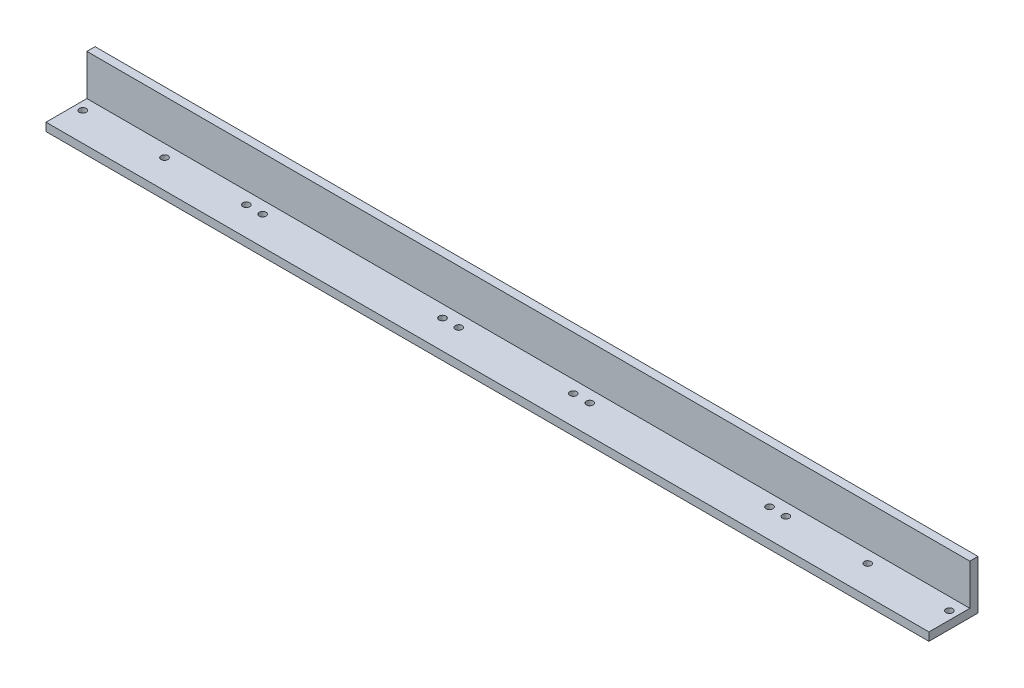
from build123d import *

# Parameters (mm, degrees)
EXTRUDE_THIN1_DEPTH = 342.9
CUT_EXTRUDE4_REACH  = 348.468
SKETCH2_R           = 2.667


with BuildPart() as part:
    # Sketch1 → Extrude-Thin1 (new, symmetric)
    with BuildSketch(Plane(origin=(0, 0, 0), x_dir=(0, 0, -1), z_dir=(1, 0, 0))):
        Polygon((-38.1, 0), (0, 0), (0, 38.1), (-6.35, 38.1), (-6.35, 6.35), (-38.1, 6.35), align=None)
    extrude(amount=EXTRUDE_THIN1_DEPTH, both=True)

    # Sketch2 → Cut-Extrude4 (cut, up to next)
    with BuildSketch(Plane(origin=(0, 6.35, 0), x_dir=(1, 0, 0), z_dir=(0, 1, 0)), mode=Mode.PRIVATE) as cut_extrude4_sk1:
        with Locations(Location((-336.55, -15.875, 0), (0, 0, 270))):
            Circle(SKETCH2_R)
    cut_extrude4_tool1 = extrude(cut_extrude4_sk1.sketch, amount=-CUT_EXTRUDE4_REACH, mode=Mode.PRIVATE) & part.part
    # Sketch2 → Cut-Extrude4 (cut, up to next)
    with BuildSketch(Plane(origin=(0, 6.35, 0), x_dir=(1, 0, 0), z_dir=(0, 1, 0)), mode=Mode.PRIVATE) as cut_extrude4_sk2:
        with Locations(Location((-273.05, -15.875, 0), (0, 0, 270))):
            Circle(SKETCH2_R)
    cut_extrude4_tool2 = extrude(cut_extrude4_sk2.sketch, amount=-CUT_EXTRUDE4_REACH, mode=Mode.PRIVATE) & part.part
    # Sketch2 → Cut-Extrude4 (cut, up to next)
    with BuildSketch(Plane(origin=(0, 6.35, 0), x_dir=(1, 0, 0), z_dir=(0, 1, 0)), mode=Mode.PRIVATE) as cut_extrude4_sk3:
        with Locations(Location((-209.55, -15.875, 0), (0, 0, 270))):
            Circle(SKETCH2_R)
    cut_extrude4_tool3 = extrude(cut_extrude4_sk3.sketch, amount=-CUT_EXTRUDE4_REACH, mode=Mode.PRIVATE) & part.part
    # Sketch2 → Cut-Extrude4 (cut, up to next)
    with BuildSketch(Plane(origin=(0, 6.35, 0), x_dir=(1, 0, 0), z_dir=(0, 1, 0)), mode=Mode.PRIVATE) as cut_extrude4_sk4:
        with Locations(Location((-196.85, -15.875, 0), (0, 0, 270))):
            Circle(SKETCH2_R)
    cut_extrude4_tool4 = extrude(cut_extrude4_sk4.sketch, amount=-CUT_EXTRUDE4_REACH, mode=Mode.PRIVATE) & part.part
    # Sketch2 → Cut-Extrude4 (cut, up to next)
    with BuildSketch(Plane(origin=(0, 6.35, 0), x_dir=(1, 0, 0), z_dir=(0, 1, 0)), mode=Mode.PRIVATE) as cut_extrude4_sk5:
        with Locations(Location((-57.15, -15.875, 0), (0, 0, 270))):
            Circle(SKETCH2_R)
    cut_extrude4_tool5 = extrude(cut_extrude4_sk5.sketch, amount=-CUT_EXTRUDE4_REACH, mode=Mode.PRIVATE) & part.part
    # Sketch2 → Cut-Extrude4 (cut, up to next)
    with BuildSketch(Plane(origin=(0, 6.35, 0), x_dir=(1, 0, 0), z_dir=(0, 1, 0)), mode=Mode.PRIVATE) as cut_extrude4_sk6:
        with Locations(Location((-44.45, -15.875, 0), (0, 0, 270))):
            Circle(SKETCH2_R)
    cut_extrude4_tool6 = extrude(cut_extrude4_sk6.sketch, amount=-CUT_EXTRUDE4_REACH, mode=Mode.PRIVATE) & part.part
    # Sketch2 → Cut-Extrude4 (cut, up to next)
    with BuildSketch(Plane(origin=(0, 6.35, 0), x_dir=(1, 0, 0), z_dir=(0, 1, 0)), mode=Mode.PRIVATE) as cut_extrude4_sk7:
        with Locations(Location((44.45, -15.875, 0), (0, 0, 270))):
            Circle(SKETCH2_R)
    cut_extrude4_tool7 = extrude(cut_extrude4_sk7.sketch, amount=-CUT_EXTRUDE4_REACH, mode=Mode.PRIVATE) & part.part
    # Sketch2 → Cut-Extrude4 (cut, up to next)
    with BuildSketch(Plane(origin=(0, 6.35, 0), x_dir=(1, 0, 0), z_dir=(0, 1, 0)), mode=Mode.PRIVATE) as cut_extrude4_sk8:
        with Locations(Location((57.15, -15.875, 0), (0, 0, 270))):
            Circle(SKETCH2_R)
    cut_extrude4_tool8 = extrude(cut_extrude4_sk8.sketch, amount=-CUT_EXTRUDE4_REACH, mode=Mode.PRIVATE) & part.part
    # Sketch2 → Cut-Extrude4 (cut, up to next)
    with BuildSketch(Plane(origin=(0, 6.35, 0), x_dir=(1, 0, 0), z_dir=(0, 1, 0)), mode=Mode.PRIVATE) as cut_extrude4_sk9:
        with Locations(Location((196.85, -15.875, 0), (0, 0, 270))):
            Circle(SKETCH2_R)
    cut_extrude4_tool9 = extrude(cut_extrude4_sk9.sketch, amount=-CUT_EXTRUDE4_REACH, mode=Mode.PRIVATE) & part.part
    # Sketch2 → Cut-Extrude4 (cut, up to next)
    with BuildSketch(Plane(origin=(0, 6.35, 0), x_dir=(1, 0, 0), z_dir=(0, 1, 0)), mode=Mode.PRIVATE) as cut_extrude4_sk10:
        with Locations(Location((209.55, -15.875, 0), (0, 0, 270))):
            Circle(SKETCH2_R)
    cut_extrude4_tool10 = extrude(cut_extrude4_sk10.sketch, amount=-CUT_EXTRUDE4_REACH, mode=Mode.PRIVATE) & part.part
    # Sketch2 → Cut-Extrude4 (cut, up to next)
    with BuildSketch(Plane(origin=(0, 6.35, 0), x_dir=(1, 0, 0), z_dir=(0, 1, 0)), mode=Mode.PRIVATE) as cut_extrude4_sk11:
        with Locations(Location((336.55, -15.875, 0), (0, 0, 270))):
            Circle(SKETCH2_R)
    cut_extrude4_tool11 = extrude(cut_extrude4_sk11.sketch, amount=-CUT_EXTRUDE4_REACH, mode=Mode.PRIVATE) & part.part
    # Sketch2 → Cut-Extrude4 (cut, up to next)
    with BuildSketch(Plane(origin=(0, 6.35, 0), x_dir=(1, 0, 0), z_dir=(0, 1, 0)), mode=Mode.PRIVATE) as cut_extrude4_sk12:
        with Locations(Location((273.05, -15.875, 0), (0, 0, 270))):
            Circle(SKETCH2_R)
    cut_extrude4_tool12 = extrude(cut_extrude4_sk12.sketch, amount=-CUT_EXTRUDE4_REACH, mode=Mode.PRIVATE) & part.part
    add(cut_extrude4_tool1.solids().sort_by_distance((-336.55, 6.35, 15.875))[0], mode=Mode.SUBTRACT)
    add(cut_extrude4_tool2.solids().sort_by_distance((-273.05, 6.35, 15.875))[0], mode=Mode.SUBTRACT)
    add(cut_extrude4_tool3.solids().sort_by_distance((-209.55, 6.35, 15.875))[0], mode=Mode.SUBTRACT)
    add(cut_extrude4_tool4.solids().sort_by_distance((-196.85, 6.35, 15.875))[0], mode=Mode.SUBTRACT)
    add(cut_extrude4_tool5.solids().sort_by_distance((-57.15, 6.35, 15.875))[0], mode=Mode.SUBTRACT)
    add(cut_extrude4_tool6.solids().sort_by_distance((-44.45, 6.35, 15.875))[0], mode=Mode.SUBTRACT)
    add(cut_extrude4_tool7.solids().sort_by_distance((44.45, 6.35, 15.875))[0], mode=Mode.SUBTRACT)
    add(cut_extrude4_tool8.solids().sort_by_distance((57.15, 6.35, 15.875))[0], mode=Mode.SUBTRACT)
    add(cut_extrude4_tool9.solids().sort_by_distance((196.85, 6.35, 15.875))[0], mode=Mode.SUBTRACT)
    add(cut_extrude4_tool10.solids().sort_by_distance((209.55, 6.35, 15.875))[0], mode=Mode.SUBTRACT)
    add(cut_extrude4_tool11.solids().sort_by_distance((336.55, 6.35, 15.875))[0], mode=Mode.SUBTRACT)
    add(cut_extrude4_tool12.solids().sort_by_distance((273.05, 6.35, 15.875))[0], mode=Mode.SUBTRACT)


solid = part.part
